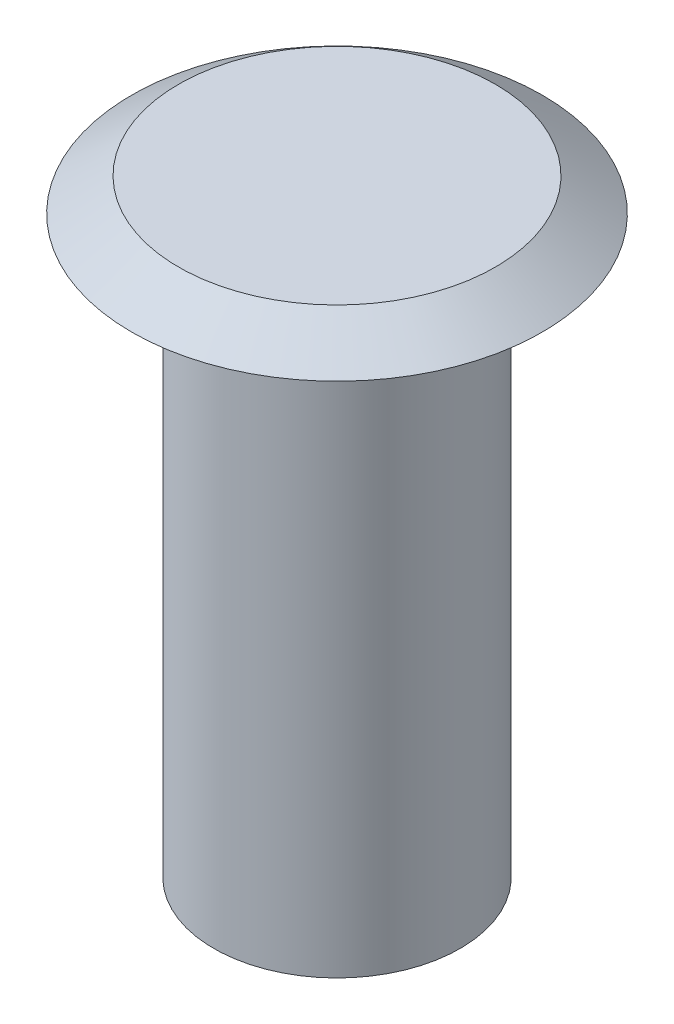
from build123d import *


with BuildPart() as part:
    # 草图1 → 旋转1 (revolve)
    with BuildSketch(Plane.XY, mode=Mode.PRIVATE) as revolve_1_sk:
        Polygon((0, 7.4), (-1.928740797, 7.4), (-2.5, 7), (-1.5, 7), (-1.5, 0), (-0.6, 0), (-0.6, 4), (0, 4), align=None)
    revolve(revolve_1_sk.sketch.rotate(Axis((0, 0, 0), (0, 1, 0)), 270), axis=Axis((0, 0, 0), (0, 1, 0)))


solid = part.part
